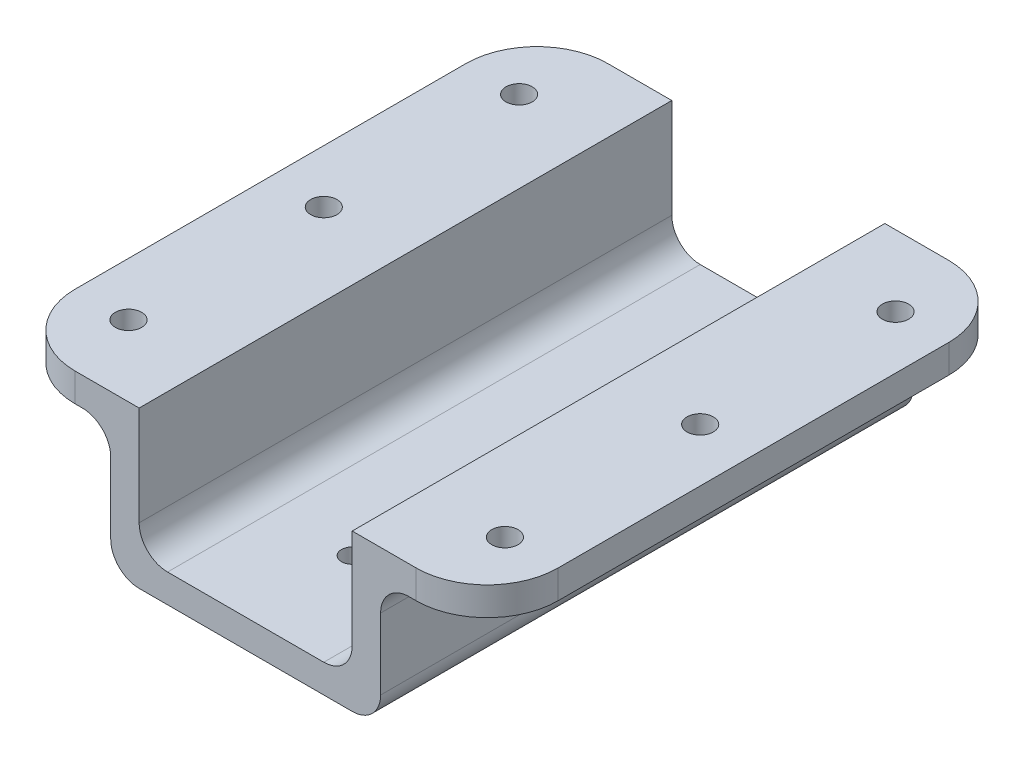
from build123d import *
from OCP.BRepFilletAPI import BRepFilletAPI_MakeFillet

# Parameters (mm, degrees)
BOSS_EXTRUDE1_DEPTH = 37.5
SKETCH2_R           = 1.5
SKETCH2_R_2         = 1.85
CUT_EXTRUDE1_DEPTH  = 56.192843739
FILLET1_R1          = 4
FILLET1_R2          = 10


with BuildPart() as part:
    # Sketch1 → Boss-Extrude1 (new, symmetric)
    with BuildSketch(Plane.XY):
        Polygon((-34, 18), (-15, 18), (-15, 0), (15, 0), (15, 18), (34, 18), (34, 14), (19, 14), (19, -4), (-19, -4), (-19, 14), (-34, 14), align=None)
    extrude(amount=BOSS_EXTRUDE1_DEPTH, both=True)

    # Sketch2 → Cut-Extrude1 (cut, through all)
    with BuildSketch(Plane.XZ.offset(4)):
        with Locations((0, 22.5)):
            Circle(SKETCH2_R)
        with Locations((0, -22.5)):
            Circle(SKETCH2_R)
        with Locations((-26.5, 27.5)):
            Circle(SKETCH2_R_2)
        with Locations((-26.5, 0)):
            Circle(SKETCH2_R_2)
        with Locations((-26.5, -27.5)):
            Circle(SKETCH2_R_2)
        with Locations((26.5, 27.5)):
            Circle(SKETCH2_R_2)
        with Locations((26.5, -27.5)):
            Circle(SKETCH2_R_2)
        with Locations((26.5, 0)):
            Circle(SKETCH2_R_2)
    extrude(amount=-CUT_EXTRUDE1_DEPTH, mode=Mode.SUBTRACT)

    # Fillet1: one fillet with a radius per group of edges: ONE call of the kernel's fillet builder (fillet() takes one radius for all edges)
    fillet1_edges_1 = [part.edges().sort_by_distance(p)[0] for p in [
        (-15, 0, 0),
        (15, 0, 0),
        (-19, -4, 0),
        (19, -4, 0),
        (19, 14, 0),
        (-19, 14, 0),
    ]]
    fillet1_edges_2 = [part.edges().sort_by_distance(p)[0] for p in [
        (-34, 16, 37.5),
        (-34, 16, -37.5),
        (34, 16, -37.5),
        (34, 16, 37.5),
    ]]
    fillet1 = BRepFilletAPI_MakeFillet(part.part.solid().wrapped)
    for e in fillet1_edges_1:
        fillet1.Add(FILLET1_R1, e.wrapped)
    for e in fillet1_edges_2:
        fillet1.Add(FILLET1_R2, e.wrapped)
    add(Compound.cast(fillet1.Shape()), mode=Mode.REPLACE)


solid = part.part
